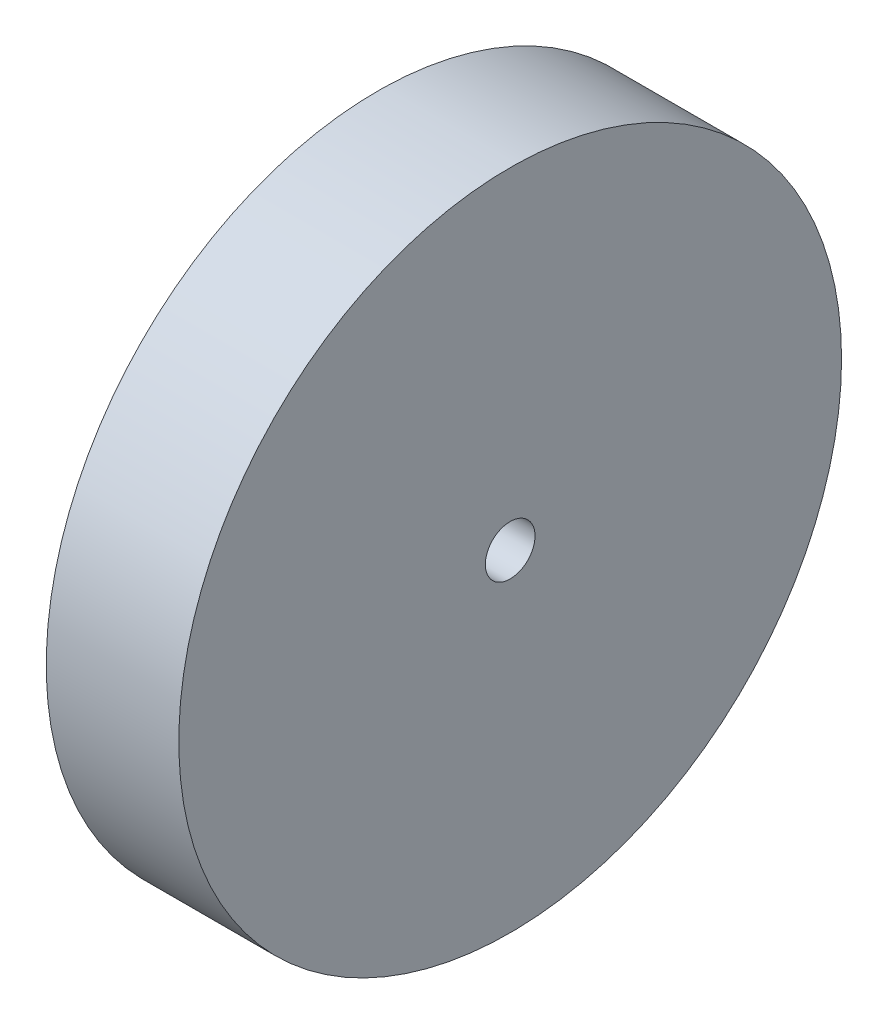
from build123d import *

# Parameters (mm, degrees)
SKETCH1_R           = 127
BOSS_EXTRUDE1_DEPTH = 50.8
SKETCH2_R           = 9.525
CUT_EXTRUDE1_DEPTH  = 50.8


with BuildPart() as part:
    # Sketch1 → Boss-Extrude1 (new body)
    with BuildSketch(Plane(origin=(0, 0, 0), x_dir=(0, 0, -1), z_dir=(1, 0, 0))):
        Circle(SKETCH1_R)
    extrude(amount=BOSS_EXTRUDE1_DEPTH)

    # Sketch2 → Cut-Extrude1 (cut)
    with BuildSketch(Plane(origin=(50.8, 0, 0), x_dir=(0, 0, -1), z_dir=(1, 0, 0))):
        Circle(SKETCH2_R)
    extrude(amount=-CUT_EXTRUDE1_DEPTH, mode=Mode.SUBTRACT)


solid = part.part
